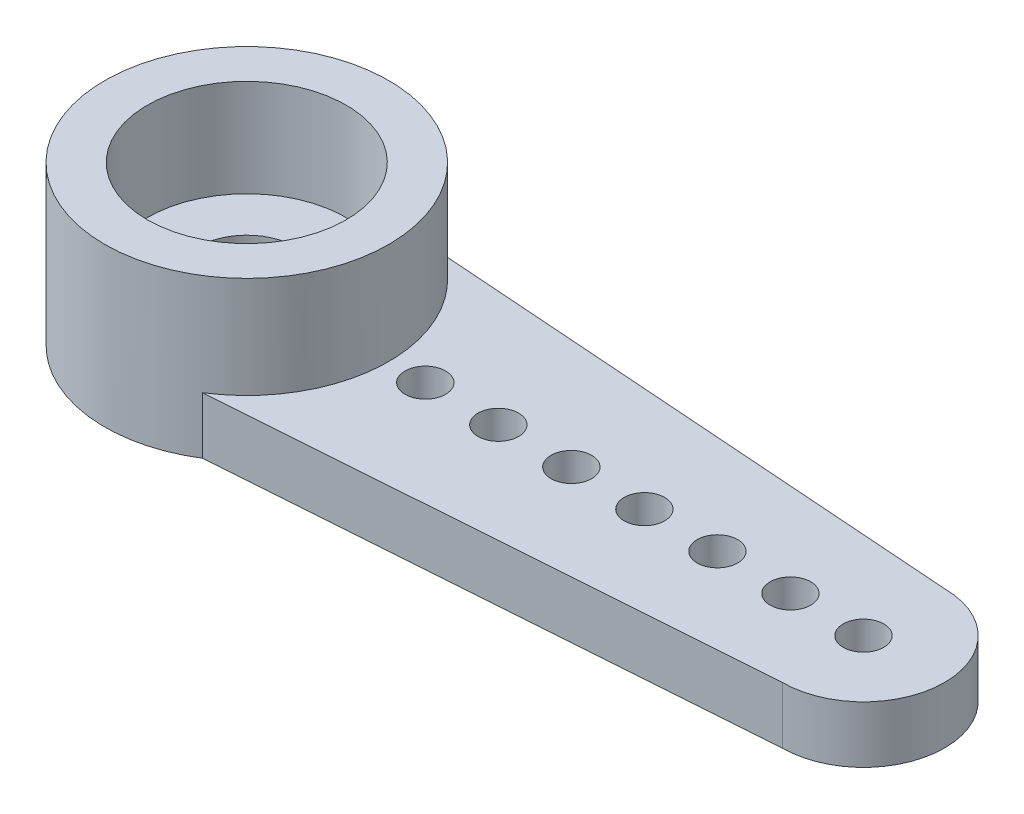
from build123d import *

# Parameters (mm, degrees)
SKETCH1_R           = 0.5
BOSS_EXTRUDE1_DEPTH = 1.4
SKETCH2_R           = 2.35
CUT_EXTRUDE1_DEPTH  = 1
SKETCH3_R           = 3.5
SKETCH3_R_2         = 2.45
BOSS_EXTRUDE2_DEPTH = 2.5
SKETCH4_R           = 1.2
CUT_EXTRUDE2_DEPTH  = 20.282440198
SKETCH5_R           = 2.45
SKETCH5_R_2         = 1.2
BOSS_EXTRUDE3_DEPTH = 0.1
SKETCH6_W           = 35.735260114
SKETCH6_H           = 17.672039004
CUT_EXTRUDE4_DEPTH  = 20.513392837
CUT_EXTRUDE5_DEPTH  = 18.980545042
SCALE1_SCALE        = 0.5
SCALE2_SCALE        = 2.5


with BuildPart() as part:
    # Sketch1 → Boss-Extrude1 (new body)
    with BuildSketch(Plane(origin=(0, 0, 0), x_dir=(1, 0, 0), z_dir=(0, 1, 0))):
        with BuildLine():
            Line((-15.2, 2), (-2, 2.95))
            Line((-2, 2.95), (-2, 6.35))
            ThreePointArc((-2, 6.35), (0, 8.35), (2, 6.35))
            Line((2, 6.35), (2, 3.5))
            Line((2, 3.5), (15.2, 2))
            ThreePointArc((15.2, 2), (17.2, 0), (15.2, -2))
            Line((15.2, -2), (2, -3.5))
            Line((2, -3.5), (2, -6.35))
            ThreePointArc((2, -6.35), (0, -8.35), (-2, -6.35))
            Line((-2, -6.35), (-2, -2.95))
            Line((-2, -2.95), (-15.2, -2))
            ThreePointArc((-15.2, -2), (-17.2, 0), (-15.2, 2))
        make_face()
        with Locations((0, 6.35)):
            Circle(SKETCH1_R, mode=Mode.SUBTRACT)
        with Locations((0, 4.55)):
            Circle(SKETCH1_R, mode=Mode.SUBTRACT)
        with Locations((0, -4.55)):
            Circle(SKETCH1_R, mode=Mode.SUBTRACT)
        with Locations((0, -6.35)):
            Circle(SKETCH1_R, mode=Mode.SUBTRACT)
        with Locations((-15.2, 0)):
            Circle(SKETCH1_R, mode=Mode.SUBTRACT)
        with Locations(Location((15.2, 0, 0), (0, 0, 270))):
            Circle(SKETCH1_R, mode=Mode.SUBTRACT)
        with Locations((-13.4, 0)):
            Circle(SKETCH1_R, mode=Mode.SUBTRACT)
        with Locations((-11.6, 0)):
            Circle(SKETCH1_R, mode=Mode.SUBTRACT)
        with Locations((-9.8, 0)):
            Circle(SKETCH1_R, mode=Mode.SUBTRACT)
        with Locations((-8, 0)):
            Circle(SKETCH1_R, mode=Mode.SUBTRACT)
        with Locations((-6.2, 0)):
            Circle(SKETCH1_R, mode=Mode.SUBTRACT)
        with Locations((-4.4, 0)):
            Circle(SKETCH1_R, mode=Mode.SUBTRACT)
        with Locations(Location((13.4, 0, 0), (0, 0, 270))):
            Circle(SKETCH1_R, mode=Mode.SUBTRACT)
        with Locations(Location((11.6, 0, 0), (0, 0, 270))):
            Circle(SKETCH1_R, mode=Mode.SUBTRACT)
        with Locations(Location((9.8, 0, 0), (0, 0, 270))):
            Circle(SKETCH1_R, mode=Mode.SUBTRACT)
        with Locations(Location((8, 0, 0), (0, 0, 270))):
            Circle(SKETCH1_R, mode=Mode.SUBTRACT)
        with Locations(Location((6.2, 0, 0), (0, 0, 270))):
            Circle(SKETCH1_R, mode=Mode.SUBTRACT)
        with Locations(Location((4.4, 0, 0), (0, 0, 270))):
            Circle(SKETCH1_R, mode=Mode.SUBTRACT)
    extrude(amount=BOSS_EXTRUDE1_DEPTH)

    # Sketch2 → Cut-Extrude1 (cut)
    with BuildSketch(Plane.XZ):
        with Locations(Location((0, 0, 0), (0, 0, 270))):
            Circle(SKETCH2_R)
    extrude(amount=-CUT_EXTRUDE1_DEPTH, mode=Mode.SUBTRACT)

    # Sketch3 → Boss-Extrude2 (add)
    with BuildSketch(Plane(origin=(0, 1.4, 0), x_dir=(1, 0, 0), z_dir=(0, 1, 0))):
        with Locations(Location((0, 0, 0), (0, 0, 57.731921145))):
            Circle(SKETCH3_R)
        with Locations(Location((0, 0, 0), (0, 0, 270))):
            Circle(SKETCH3_R_2, mode=Mode.SUBTRACT)
    extrude(amount=BOSS_EXTRUDE2_DEPTH)

    # Sketch4 → Cut-Extrude2 (cut, through all)
    with BuildSketch(Plane(origin=(0, 1.4, 0), x_dir=(1, 0, 0), z_dir=(0, 1, 0))):
        with Locations(Location((0, 0, 0), (0, 0, 270))):
            Circle(SKETCH4_R)
    extrude(amount=-CUT_EXTRUDE2_DEPTH, mode=Mode.SUBTRACT)

    # Sketch5 → Boss-Extrude3 (add)
    with BuildSketch(Plane(origin=(0, 1.4, 0), x_dir=(1, 0, 0), z_dir=(0, 1, 0))):
        with Locations(Location((0, 0, 0), (0, 0, 270))):
            Circle(SKETCH5_R)
        with Locations(Location((0, 0, 0), (0, 0, 270))):
            Circle(SKETCH5_R_2, mode=Mode.SUBTRACT)
    extrude(amount=BOSS_EXTRUDE3_DEPTH)

    # Sketch6 → Cut-Extrude4 (cut, through all)
    with BuildSketch(Plane.XZ):
        Rectangle(SKETCH6_W, SKETCH6_H)
        with BuildLine():
            Line((-1.868584713, -2.959457918), (-15.2, -2))
            ThreePointArc((-15.2, -2), (-17.2, 0), (-15.2, 2))
            Line((-15.2, 2), (-1.868584713, 2.959457918))
            ThreePointArc((-1.868584713, 2.959457918), (0, 3.5), (1.868584713, 2.959457918))
            Line((1.868584713, 2.959457918), (15.2, 2))
            ThreePointArc((15.2, 2), (17.2, 0), (15.2, -2))
            Line((15.2, -2), (1.868584713, -2.959457918))
            ThreePointArc((1.868584713, -2.959457918), (0, -3.5), (-1.868584713, -2.959457918))
        make_face(mode=Mode.SUBTRACT)
    extrude(amount=-CUT_EXTRUDE4_DEPTH, mode=Mode.SUBTRACT)

    # Sketch7 → Cut-Extrude5 (cut, through all)
    with BuildSketch(Plane.XZ):
        with BuildLine():
            Line((0, 3.5), (-17.731768104, 3.5))
            Line((-17.731768104, 3.5), (-17.731768104, -3.5))
            Line((-17.731768104, -3.5), (0, -3.5))
            ThreePointArc((0, -3.5), (-3.5, 0), (0, 3.5))
        make_face()
    extrude(amount=-CUT_EXTRUDE5_DEPTH, mode=Mode.SUBTRACT)


with BuildPart() as part_1:
    # Scale1: scaled about (4.675225988, 1.286509447, 0)
    add(part.part.scale(SCALE1_SCALE).moved(Location((2.337612994, 0.643254724, 0))))


with BuildPart() as part_2:
    # Scale2: scaled about (4.675225988, 1.286509447, 0)
    add(part_1.part.scale(SCALE2_SCALE).moved(Location((-7.012838982, -1.92976417, 0))))


solid = part_2.part
